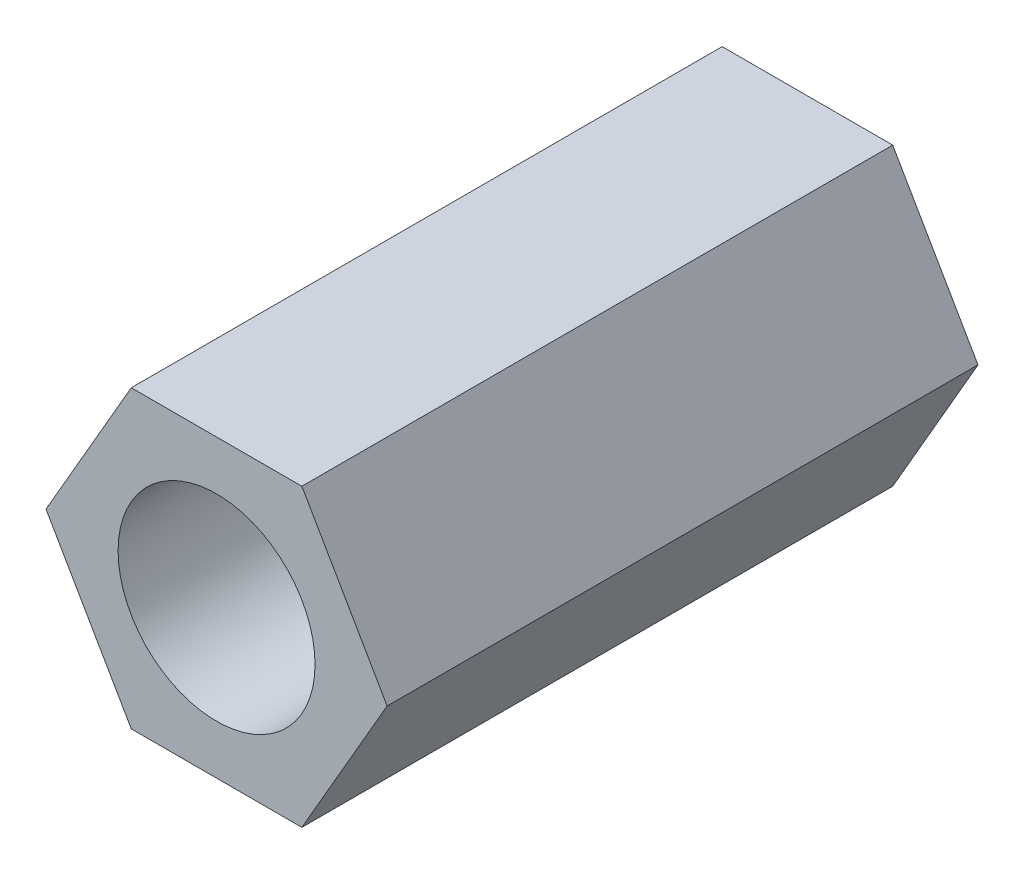
from build123d import *

# Parameters (mm, degrees)
BOSS_EXTRUDE1_DEPTH = 38.1
SKETCH2_R           = 6.35
CUT_EXTRUDE1_DEPTH  = 41.783613437


with BuildPart() as part:
    # Sketch1 → Boss-Extrude1 (new body)
    with BuildSketch(Plane.XY):
        Polygon((-10.998522628, 0), (-5.499261314, -9.525), (5.499261314, -9.525), (10.998522628, 0), (5.499261314, 9.525), (-5.499261314, 9.525), align=None)
    extrude(amount=BOSS_EXTRUDE1_DEPTH)

    # Sketch2 → Cut-Extrude1 (cut, through all)
    with BuildSketch(Plane.XY.offset(38.1)):
        Circle(SKETCH2_R)
    extrude(amount=-CUT_EXTRUDE1_DEPTH, mode=Mode.SUBTRACT)


solid = part.part
